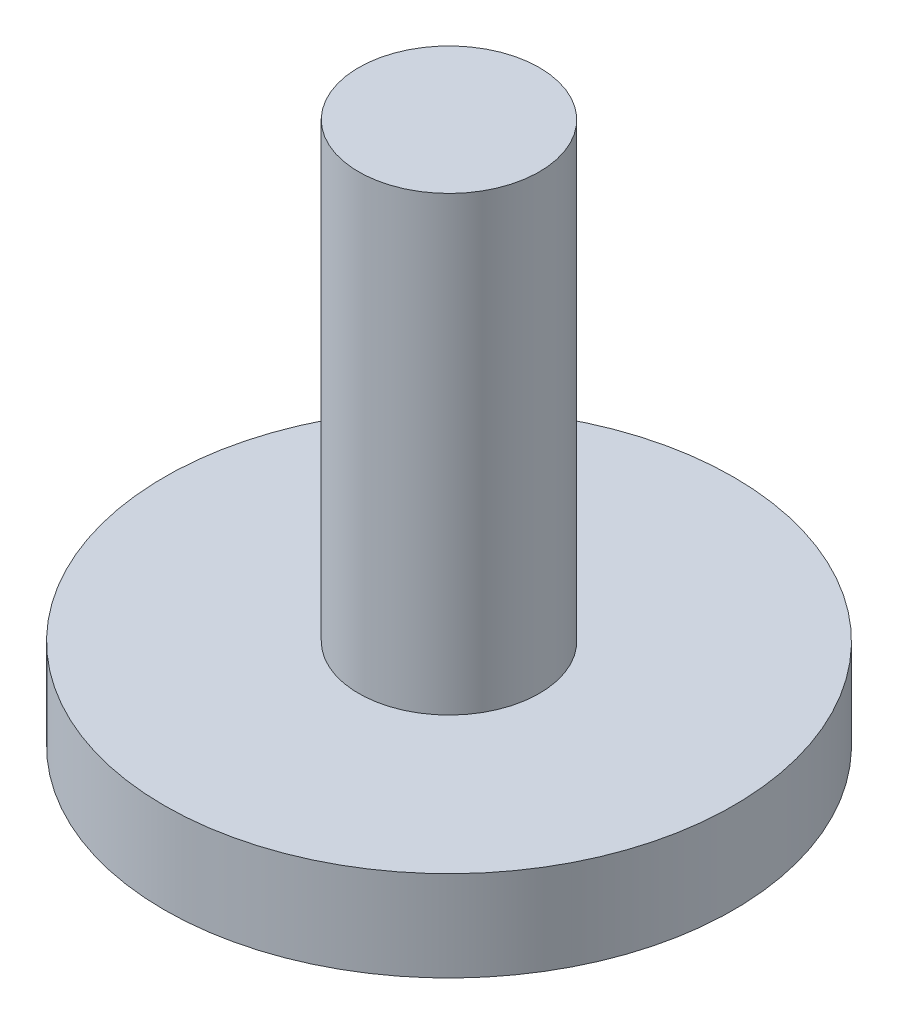
from build123d import *


with BuildPart() as part:
    # Sketch1 → Revolve1 (revolve)
    with BuildSketch(Plane.XY, mode=Mode.PRIVATE) as revolve1_sk:
        Polygon((0, 0), (-15.75, 0), (-15.75, 5), (-5, 5), (-5, 30), (0, 30), align=None)
    revolve(revolve1_sk.sketch.rotate(Axis((0, 0, 0), (0, 1, 0)), 270), axis=Axis((0, 0, 0), (0, 1, 0)))


solid = part.part
